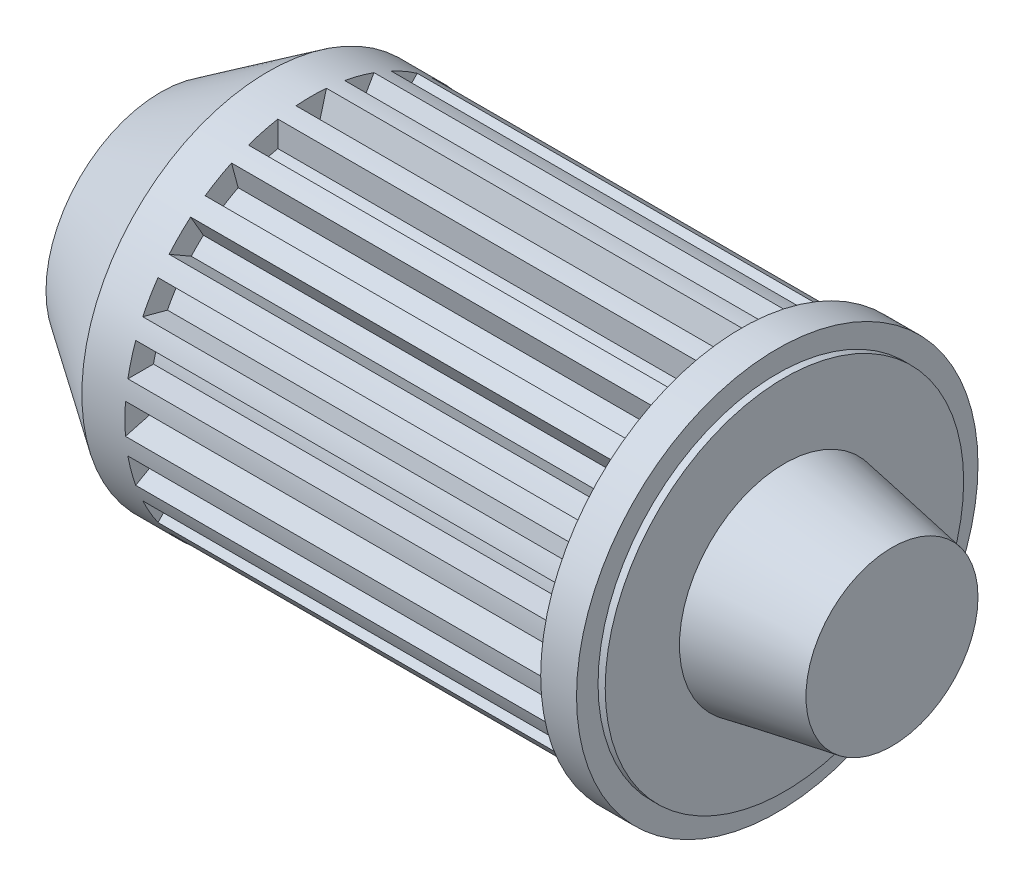
from build123d import *

# Parameters (mm, degrees)
SKETCH1_R           = 280
BOSS_EXTRUDE1_DEPTH = 50
SKETCH2_R           = 250
BOSS_EXTRUDE2_DEPTH = 10
SKETCH3_R           = 120
BOSS_EXTRUDE3_DEPTH = 150
DRAFT1_ANGLE        = 10
SKETCH4_R           = 260
BOSS_EXTRUDE4_DEPTH = 600
CUT_EXTRUDE1_START  = -600
CUT_EXTRUDE1_DEPTH  = 600
SKETCH6_R           = 225
BOSS_EXTRUDE5_DEPTH = 600
SKETCH7_R           = 260
BOSS_EXTRUDE6_DEPTH = 60
SKETCH9_R           = 160


with BuildPart() as part:
    # Sketch1 → Boss-Extrude1 (new body)
    with BuildSketch(Plane(origin=(0, 0, 0), x_dir=(0, 0, -1), z_dir=(1, 0, 0))):
        Circle(SKETCH1_R)
    extrude(amount=BOSS_EXTRUDE1_DEPTH)

    # Sketch2 → Boss-Extrude2 (add)
    with BuildSketch(Plane(origin=(50, 0, 0), x_dir=(0, 0, -1), z_dir=(1, 0, 0))):
        Circle(SKETCH2_R)
    extrude(amount=BOSS_EXTRUDE2_DEPTH)

    # Sketch3 → Boss-Extrude3 (add)
    with BuildSketch(Plane(origin=(60, 0, 0), x_dir=(0, 0, -1), z_dir=(1, 0, 0))):
        Circle(SKETCH3_R)
    extrude(amount=BOSS_EXTRUDE3_DEPTH)

    # Draft1
    draft1_faces = [part.faces().sort_by_distance(p)[0] for p in [
        (135, 0, 120),
    ]]
    draft(draft1_faces, Plane(origin=(210, 0, 0), x_dir=(0, 0, 1), z_dir=(1, 0, 0)), DRAFT1_ANGLE)

    # Sketch4 → Boss-Extrude4 (add)
    with BuildSketch(Plane.ZY):
        Circle(SKETCH4_R)
    extrude(amount=BOSS_EXTRUDE4_DEPTH)

    # Sketch5 → Cut-Extrude1 (cut)
    with BuildSketch(Plane.ZY.offset(600).offset(CUT_EXTRUDE1_START)):
        with BuildLine():
            Line((87.550166574, 244.816192955), (46.587428118, 173.866648732))
            Line((46.587428118, 173.866648732), (46.587428118, 255.792125644))
            ThreePointArc((46.587428118, 255.792125644), (67.292951727, 251.140714835), (87.550166574, 244.816192955))
        make_face()
        with BuildLine():
            Line((21.203873704, 259.13393398), (0, 180))
            Line((0, 180), (-21.203873704, 259.13393398))
            ThreePointArc((-21.203873704, 259.13393398), (0, 260), (21.203873704, 259.13393398))
        make_face()
        with BuildLine():
            Line((147.930060276, 213.814632957), (90, 155.884572681))
            Line((90, 155.884572681), (111.203873704, 235.018506661))
            ThreePointArc((111.203873704, 235.018506661), (130, 225.166604984), (147.930060276, 213.814632957))
        make_face()
        with BuildLine():
            Line((198.228764836, 168.241959069), (127.279220614, 127.279220614))
            Line((127.279220614, 127.279220614), (168.241959069, 198.228764836))
            ThreePointArc((168.241959069, 198.228764836), (183.847763109, 183.847763109), (198.228764836, 168.241959069))
        make_face()
        with BuildLine():
            Line((235.018506661, 111.203873704), (155.884572681, 90))
            Line((155.884572681, 90), (213.814632957, 147.930060276))
            ThreePointArc((213.814632957, 147.930060276), (225.166604984, 130), (235.018506661, 111.203873704))
        make_face()
        with BuildLine():
            Line((255.792125644, 46.587428118), (173.866648732, 46.587428118))
            Line((173.866648732, 46.587428118), (244.816192955, 87.550166574))
            ThreePointArc((244.816192955, 87.550166574), (251.140714835, 67.292951727), (255.792125644, 46.587428118))
        make_face()
        with BuildLine():
            Line((259.13393398, -21.203873704), (180, 0))
            Line((180, 0), (259.13393398, 21.203873704))
            ThreePointArc((259.13393398, 21.203873704), (260, 0), (259.13393398, -21.203873704))
        make_face()
        with BuildLine():
            Line((244.816192955, -87.550166574), (173.866648732, -46.587428118))
            Line((173.866648732, -46.587428118), (255.792125644, -46.587428118))
            ThreePointArc((255.792125644, -46.587428118), (251.140714835, -67.292951727), (244.816192955, -87.550166574))
        make_face()
        with BuildLine():
            Line((213.814632957, -147.930060276), (155.884572681, -90))
            Line((155.884572681, -90), (235.018506661, -111.203873704))
            ThreePointArc((235.018506661, -111.203873704), (225.166604984, -130), (213.814632957, -147.930060276))
        make_face()
        with BuildLine():
            Line((168.241959069, -198.228764836), (127.279220614, -127.279220614))
            Line((127.279220614, -127.279220614), (198.228764836, -168.241959069))
            ThreePointArc((198.228764836, -168.241959069), (183.847763109, -183.847763109), (168.241959069, -198.228764836))
        make_face()
        with BuildLine():
            Line((111.203873704, -235.018506661), (90, -155.884572681))
            Line((90, -155.884572681), (147.930060276, -213.814632957))
            ThreePointArc((147.930060276, -213.814632957), (130, -225.166604984), (111.203873704, -235.018506661))
        make_face()
        with BuildLine():
            Line((46.587428118, -255.792125644), (46.587428118, -173.866648732))
            Line((46.587428118, -173.866648732), (87.550166574, -244.816192955))
            ThreePointArc((87.550166574, -244.816192955), (67.292951727, -251.140714835), (46.587428118, -255.792125644))
        make_face()
        with BuildLine():
            Line((-21.203873704, -259.13393398), (0, -180))
            Line((0, -180), (21.203873704, -259.13393398))
            ThreePointArc((21.203873704, -259.13393398), (0, -260), (-21.203873704, -259.13393398))
        make_face()
        with BuildLine():
            Line((-87.550166574, -244.816192955), (-46.587428118, -173.866648732))
            Line((-46.587428118, -173.866648732), (-46.587428118, -255.792125644))
            ThreePointArc((-46.587428118, -255.792125644), (-67.292951727, -251.140714835), (-87.550166574, -244.816192955))
        make_face()
        with BuildLine():
            Line((-147.930060276, -213.814632957), (-90, -155.884572681))
            Line((-90, -155.884572681), (-111.203873704, -235.018506661))
            ThreePointArc((-111.203873704, -235.018506661), (-130, -225.166604984), (-147.930060276, -213.814632957))
        make_face()
        with BuildLine():
            Line((-198.228764836, -168.241959069), (-127.279220614, -127.279220614))
            Line((-127.279220614, -127.279220614), (-168.241959069, -198.228764836))
            ThreePointArc((-168.241959069, -198.228764836), (-183.847763109, -183.847763109), (-198.228764836, -168.241959069))
        make_face()
        with BuildLine():
            Line((-235.018506661, -111.203873704), (-155.884572681, -90))
            Line((-155.884572681, -90), (-213.814632957, -147.930060276))
            ThreePointArc((-213.814632957, -147.930060276), (-225.166604984, -130), (-235.018506661, -111.203873704))
        make_face()
        with BuildLine():
            Line((-255.792125644, -46.587428118), (-173.866648732, -46.587428118))
            Line((-173.866648732, -46.587428118), (-244.816192955, -87.550166574))
            ThreePointArc((-244.816192955, -87.550166574), (-251.140714835, -67.292951727), (-255.792125644, -46.587428118))
        make_face()
        with BuildLine():
            Line((-259.13393398, 21.203873704), (-180, 0))
            Line((-180, 0), (-259.13393398, -21.203873704))
            ThreePointArc((-259.13393398, -21.203873704), (-260, 0), (-259.13393398, 21.203873704))
        make_face()
        with BuildLine():
            Line((-244.816192955, 87.550166574), (-173.866648732, 46.587428118))
            Line((-173.866648732, 46.587428118), (-255.792125644, 46.587428118))
            ThreePointArc((-255.792125644, 46.587428118), (-251.140714835, 67.292951727), (-244.816192955, 87.550166574))
        make_face()
        with BuildLine():
            Line((-213.814632957, 147.930060276), (-155.884572681, 90))
            Line((-155.884572681, 90), (-235.018506661, 111.203873704))
            ThreePointArc((-235.018506661, 111.203873704), (-225.166604984, 130), (-213.814632957, 147.930060276))
        make_face()
        with BuildLine():
            Line((-168.241959069, 198.228764836), (-127.279220614, 127.279220614))
            Line((-127.279220614, 127.279220614), (-198.228764836, 168.241959069))
            ThreePointArc((-198.228764836, 168.241959069), (-183.847763109, 183.847763109), (-168.241959069, 198.228764836))
        make_face()
        with BuildLine():
            Line((-111.203873704, 235.018506661), (-90, 155.884572681))
            Line((-90, 155.884572681), (-147.930060276, 213.814632957))
            ThreePointArc((-147.930060276, 213.814632957), (-130, 225.166604984), (-111.203873704, 235.018506661))
        make_face()
        with BuildLine():
            Line((-46.587428118, 255.792125644), (-46.587428118, 173.866648732))
            Line((-46.587428118, 173.866648732), (-87.550166574, 244.816192955))
            ThreePointArc((-87.550166574, 244.816192955), (-67.292951727, 251.140714835), (-46.587428118, 255.792125644))
        make_face()
    extrude(amount=CUT_EXTRUDE1_DEPTH, mode=Mode.SUBTRACT)

    # Sketch6 → Boss-Extrude5 (add)
    with BuildSketch(Plane.ZY.offset(600)):
        Circle(SKETCH6_R)
    extrude(amount=-BOSS_EXTRUDE5_DEPTH)

    # Sketch7 → Boss-Extrude6 (add)
    with BuildSketch(Plane.ZY.offset(600)):
        with Locations(Location((0, 0, 0), (0, 0, 184.677858529))):
            Circle(SKETCH7_R)
    extrude(amount=BOSS_EXTRUDE6_DEPTH)

    # Sketch9 → section 1 of loft1
    with BuildSketch(Plane.ZY.offset(810), mode=Mode.PRIVATE) as loft1_s1:
        Circle(SKETCH9_R)
    # loft from a face of the part (loft1)
    loft([part.faces().sort_by_distance((-660, 0, 0))[0], loft1_s1.sketch])


solid = part.part
